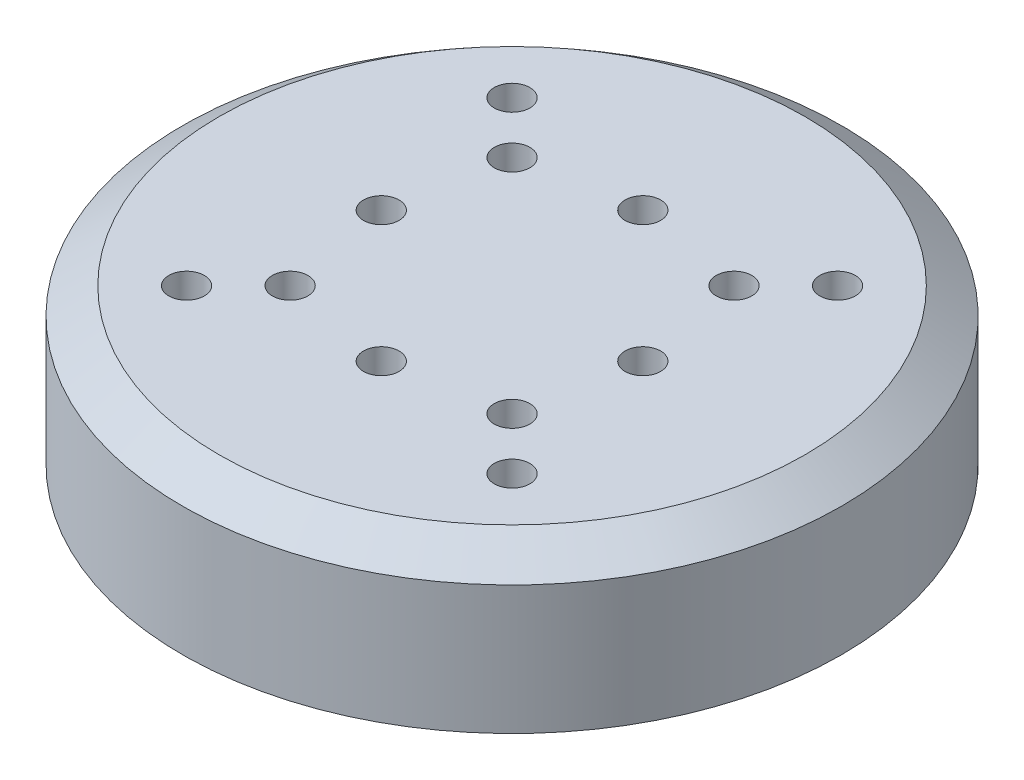
from build123d import *

# Parameters (mm, degrees)
M3_CLEARANCE_HOLE1_D     = 3.4
M3_CLEARANCE_HOLE1_DEPTH = 4
M3_CLEARANCE_HOLE1_TIP   = 1.021463052
SKETCH5_R                = 29.5
CUT_EXTRUDE1_DEPTH       = 1


with BuildPart() as part:
    # Sketch1 → Revolve1 (revolve)
    with BuildSketch(Plane.XY, mode=Mode.PRIVATE) as revolve1_sk:
        Polygon((0, -7.4), (0, 7.4), (-28, 7.4), (-31.5, 4.9), (-31.5, -7.4), align=None)
    revolve(revolve1_sk.sketch.rotate(Axis((0, -7.4, 0), (0, 1, 0)), 180), axis=Axis((0, -7.4, 0), (0, 1, 0)))

    # M3 Clearance Hole1
    with Locations(Plane(origin=(0, 7.4, 0), x_dir=(1, 0, 0), z_dir=(0, 1, 0))):
        with Locations((-15.556349186, 15.556349186), (-10.606601718, 10.606601718), (0, 12.5), (10.606601718, 10.606601718), (15.556349186, 15.556349186), (0, -12.5), (-12.5, 0), (12.5, 0), (10.606601718, -10.606601718), (-10.606601718, -10.606601718), (-15.556349186, -15.556349186), (15.556349186, -15.556349186)):
            Hole(M3_CLEARANCE_HOLE1_D / 2, depth=M3_CLEARANCE_HOLE1_DEPTH)
            with Locations((0, 0, -(M3_CLEARANCE_HOLE1_DEPTH + M3_CLEARANCE_HOLE1_TIP / 2))):  # 118° drill point
                Cone(0, M3_CLEARANCE_HOLE1_D / 2, M3_CLEARANCE_HOLE1_TIP, mode=Mode.SUBTRACT)

    # Sketch5 → Cut-Extrude1 (cut)
    with BuildSketch(Plane.XZ.offset(7.4)):
        Circle(SKETCH5_R)
    extrude(amount=-CUT_EXTRUDE1_DEPTH, mode=Mode.SUBTRACT)


solid = part.part
